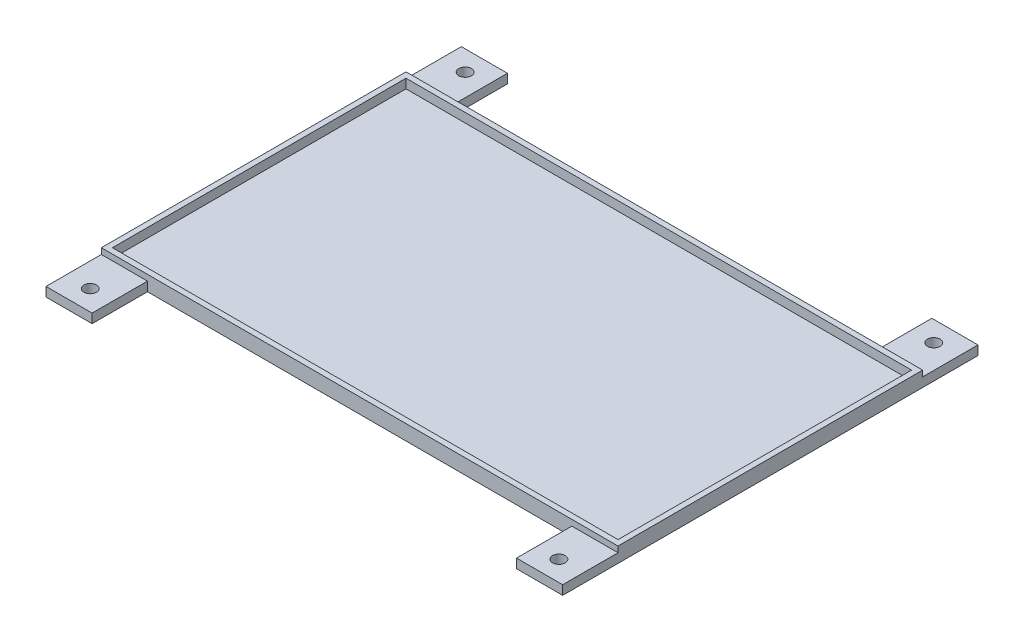
from build123d import *

# Parameters (mm, degrees)
SKETCH1_W           = 280
SKETCH1_H           = 165.1
BOSS_EXTRUDE1_DEPTH = 3.175
SKETCH2_W           = 280
SKETCH2_H           = 165.1
SKETCH2_W_2         = 274
SKETCH2_H_2         = 159.1
BOSS_EXTRUDE2_DEPTH = 5
SKETCH3_W           = 25
SKETCH3_H           = 30
SKETCH3_R           = 3.429
BOSS_EXTRUDE3_DEPTH = 5


with BuildPart() as part:
    # Sketch1 → Boss-Extrude1 (new body)
    with BuildSketch(Plane(origin=(0, 0, 0), x_dir=(1, 0, 0), z_dir=(0, 1, 0))):
        Rectangle(SKETCH1_W, SKETCH1_H)
    extrude(amount=BOSS_EXTRUDE1_DEPTH)

    # Sketch2 → Boss-Extrude2 (add)
    with BuildSketch(Plane(origin=(0, 3.175, 0), x_dir=(1, 0, 0), z_dir=(0, 1, 0))):
        Rectangle(SKETCH2_W, SKETCH2_H)
        Rectangle(SKETCH2_W_2, SKETCH2_H_2, mode=Mode.SUBTRACT)
    extrude(amount=BOSS_EXTRUDE2_DEPTH)

    # Sketch3 → Boss-Extrude3 (add)
    # profile 1 of 4: a face of its own
    with BuildSketch(Plane(origin=(0, 0, 0), x_dir=(1, 0, 0), z_dir=(0, 1, 0))):
        with Locations((-127.5, 97.55)):
            Rectangle(SKETCH3_W, SKETCH3_H)
        with Locations(Location((-127, 101.6, 0), (0, 0, 270))):
            Circle(SKETCH3_R, mode=Mode.SUBTRACT)
    # profile 2 of 4: a face of its own
    with BuildSketch(Plane(origin=(0, 0, 0), x_dir=(1, 0, 0), z_dir=(0, 1, 0))):
        with Locations((127.5, 97.55)):
            Rectangle(SKETCH3_W, SKETCH3_H)
        with Locations(Location((127, 101.6, 0), (0, 0, 270))):
            Circle(SKETCH3_R, mode=Mode.SUBTRACT)
    # profile 3 of 4: a face of its own
    with BuildSketch(Plane(origin=(0, 0, 0), x_dir=(1, 0, 0), z_dir=(0, 1, 0))):
        with Locations((-127.5, -97.55)):
            Rectangle(SKETCH3_W, SKETCH3_H)
        with Locations(Location((-127, -101.6, 0), (0, 0, 270))):
            Circle(SKETCH3_R, mode=Mode.SUBTRACT)
    # profile 4 of 4: a face of its own
    with BuildSketch(Plane(origin=(0, 0, 0), x_dir=(1, 0, 0), z_dir=(0, 1, 0))):
        with Locations((127.5, -97.55)):
            Rectangle(SKETCH3_W, SKETCH3_H)
        with Locations(Location((127, -101.6, 0), (0, 0, 270))):
            Circle(SKETCH3_R, mode=Mode.SUBTRACT)
    extrude(amount=BOSS_EXTRUDE3_DEPTH)


solid = part.part
